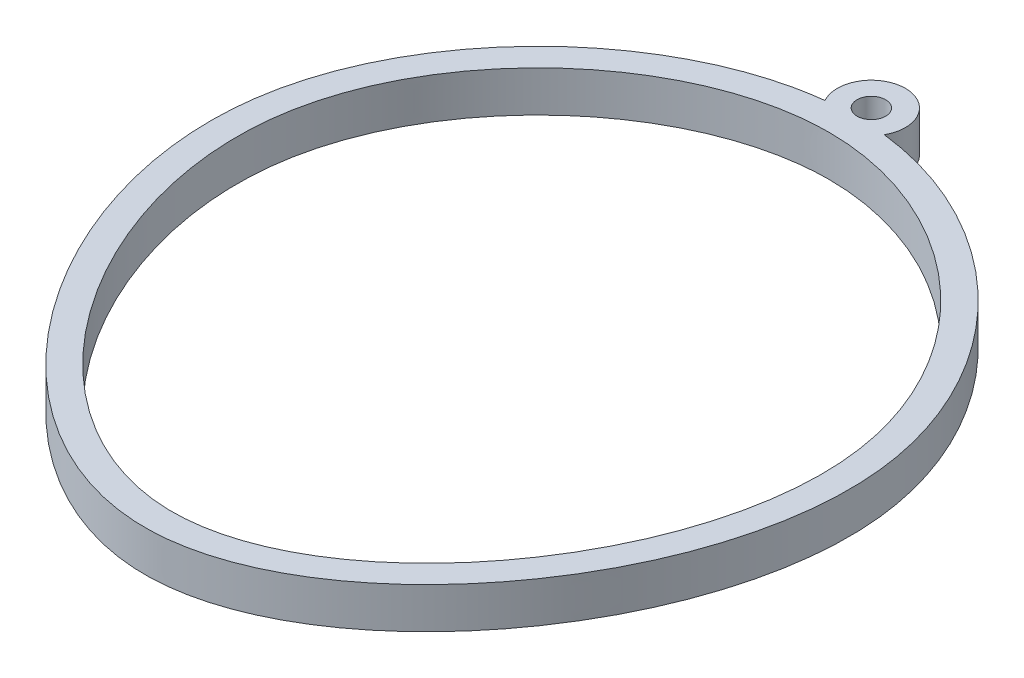
from build123d import *

# Parameters (mm, degrees)
SKETCH1_R           = 1.05
BOSS_EXTRUDE1_DEPTH = 3


with BuildPart() as part:
    # Sketch1 → Boss-Extrude1 (new body)
    # profile 1 of 2: a face of its own
    with BuildSketch(Plane(origin=(0, 0, 0), x_dir=(1, 0, 0), z_dir=(0, 1, 0))):
        with BuildLine():
            add(Edge.make_bspline(
                [(0, 21.143), (0.727025102, 21.143), (1.454050205, 21.099945148), (2.178277681, 21.016172244)],
                knots=[0, 0, 0, 0, 0.014923332, 0.014923332, 0.014923332, 0.014923332], degree=3))
            ThreePointArc((2.178277681, 21.016172244), (0, 24.743), (-2.178277681, 21.016172244))
            add(Edge.make_bspline(
                [(-2.178277681, 21.016172244), (-1.454050205, 21.099945148), (-0.727025102, 21.143), (0, 21.143)],
                knots=[0.985076668, 0.985076668, 0.985076668, 0.985076668, 1, 1, 1, 1], degree=3))
        make_face()
        with Locations(Location((0, 22.243, 0), (0, 0, 270))):
            Circle(SKETCH1_R, mode=Mode.SUBTRACT)
    # profile 2 of 2: a face of its own
    with BuildSketch(Plane(origin=(0, 0, 0), x_dir=(1, 0, 0), z_dir=(0, 1, 0))):
        with BuildLine():
            add(Edge.make_bspline(
                [(0, 21.143), (10.895147515, 21.143), (35.253819525, -0.474726308), (0, -48.047385757), (-35.253819525, -0.474726308), (-10.895147515, 21.143), (0, 21.143)],
                knots=[0, 0, 0, 0, 0.223640014, 0.5, 0.776359986, 1, 1, 1, 1], degree=3))
        make_face()
        with BuildLine():
            add(Edge.make_bspline(
                [(0, 19.143), (9.903550643, 19.143), (32.285315288, -0.506820584), (0, -45.061430974), (-32.285315288, -0.506820584), (-9.903550643, 19.143), (0, 19.143)],
                knots=[0, 0, 0, 0, 0.221241506, 0.5, 0.778758494, 1, 1, 1, 1], degree=3))
        make_face(mode=Mode.SUBTRACT)
    extrude(amount=BOSS_EXTRUDE1_DEPTH)


solid = part.part
